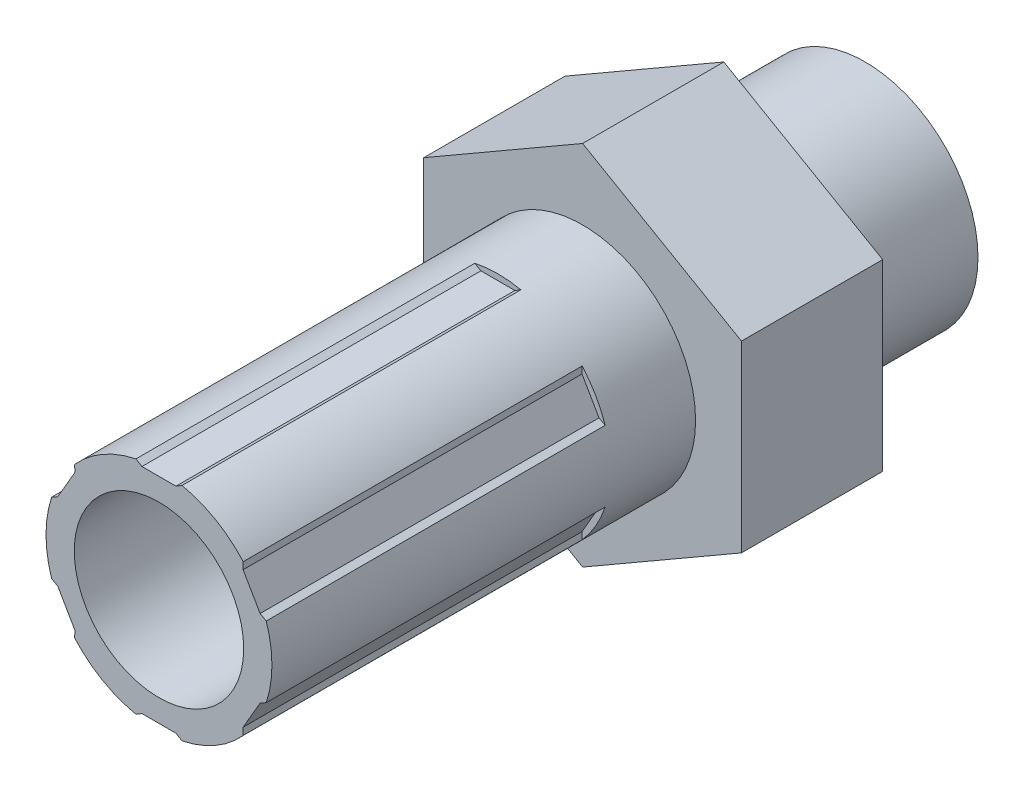
from build123d import *

# Parameters (mm, degrees)
BOSS_EXTRUDE1_DEPTH = 6.35
SKETCH2_R           = 5.08
BOSS_EXTRUDE2_DEPTH = 6.35
BOSS_EXTRUDE3_START = 19.05
SKETCH3_R           = 5.08
BOSS_EXTRUDE3_DEPTH = 19.05
SKETCH4_R           = 3.81
CUT_EXTRUDE1_DEPTH  = 34.572903997
CUT_EXTRUDE2_DEPTH  = 15.24
CIRPATTERN1_COUNT   = 6


with BuildPart() as part:
    # Sketch1 → Boss-Extrude1 (new body)
    with BuildSketch(Plane.XY):
        Polygon((0, 8.248891971), (-7.14375, 4.124445986), (-7.14375, -4.124445986), (0, -8.248891971), (7.14375, -4.124445986), (7.14375, 4.124445986), align=None)
    extrude(amount=BOSS_EXTRUDE1_DEPTH)

    # Sketch2 → Boss-Extrude2 (add)
    with BuildSketch(Plane(origin=(0, 0, 0), x_dir=(-1, 0, 0), z_dir=(0, 0, -1))):
        with Locations(Location((0, 0, 0), (0, 0, 180))):
            Circle(SKETCH2_R)
    extrude(amount=BOSS_EXTRUDE2_DEPTH)

    # Sketch3 → Boss-Extrude3 (add)
    with BuildSketch(Plane.XY.offset(6.35).offset(BOSS_EXTRUDE3_START)):
        Circle(SKETCH3_R)
    extrude(amount=-BOSS_EXTRUDE3_DEPTH)

    # Sketch4 → Cut-Extrude1 (cut, through all)
    with BuildSketch(Plane.XY.offset(25.4)):
        Circle(SKETCH4_R)
    extrude(amount=-CUT_EXTRUDE1_DEPTH, mode=Mode.SUBTRACT)

    # Sketch5 → Cut-Extrude2 (cut)
    with BuildSketch(Plane.XY.offset(25.4)):
        Polygon((0, 4.810914796), (0.765045953, 4.810914796), (1.27, 5.114868927), (0, 5.114868927), (-1.27, 5.114868927), (-0.765045953, 4.810914796), align=None)
    cut_extrude2 = extrude(amount=-CUT_EXTRUDE2_DEPTH, mode=Mode.SUBTRACT)

    # CirPattern1: Cut-Extrude2 ×6 about axis
    cirpattern1_axis = Axis((0, 0, 0), (0, 0, 1))
    for i in range(1, CIRPATTERN1_COUNT):
        add(cut_extrude2.rotate(cirpattern1_axis, i * 360 / CIRPATTERN1_COUNT), mode=Mode.SUBTRACT)


solid = part.part
